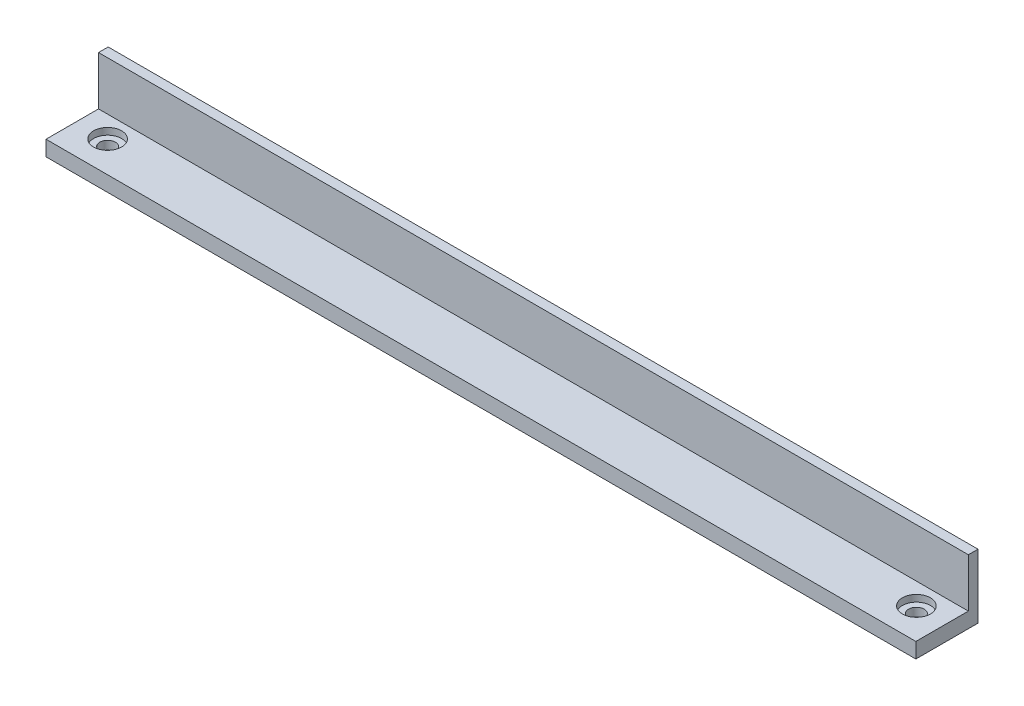
from build123d import *

# Parameters (mm, degrees)
SKETCH1_W           = 285
SKETCH1_H           = 17.2
SKETCH1_R           = 4.6
SKETCH1_H_2         = 3.16
SKETCH1_R_2         = 2.55
BOSS_EXTRUDE1_DEPTH = 5
BOSS_EXTRUDE2_START = 5
SKETCH1_3_W         = 285
SKETCH1_3_H         = 3.16
BOSS_EXTRUDE2_DEPTH = 16
CUT_EXTRUDE1_START  = 2.8
SKETCH1_5_R         = 4.6
SKETCH1_5_R_2       = 2.55
CUT_EXTRUDE1_DEPTH  = 2.2


with BuildPart() as part:
    # Sketch1 → Boss-Extrude1 (new body)
    # profile 1 of 4: a face of its own
    with BuildSketch(Plane(origin=(0, 0, 0), x_dir=(1, 0, 0), z_dir=(0, 1, 0))):
        with Locations((0, -1.58)):
            Rectangle(SKETCH1_W, SKETCH1_H)
        with Locations((-132.5, 0)):
            Circle(SKETCH1_R, mode=Mode.SUBTRACT)
        with Locations((132.5, 0)):
            Circle(SKETCH1_R, mode=Mode.SUBTRACT)
    # profile 2 of 4: a face of its own
    with BuildSketch(Plane(origin=(0, 0, 0), x_dir=(1, 0, 0), z_dir=(0, 1, 0))):
        with Locations((0, 8.6)):
            Rectangle(SKETCH1_W, SKETCH1_H_2)
    # profile 3 of 4: a face of its own
    with BuildSketch(Plane(origin=(0, 0, 0), x_dir=(1, 0, 0), z_dir=(0, 1, 0))):
        with Locations((-132.5, 0)):
            Circle(SKETCH1_R)
        with Locations(Location((-132.5, 0, 0), (0, 0, 270))):
            Circle(SKETCH1_R_2, mode=Mode.SUBTRACT)
    # profile 4 of 4: a face of its own
    with BuildSketch(Plane(origin=(0, 0, 0), x_dir=(1, 0, 0), z_dir=(0, 1, 0))):
        with Locations((132.5, 0)):
            Circle(SKETCH1_R)
        with Locations(Location((132.5, 0, 0), (0, 0, 270))):
            Circle(SKETCH1_R_2, mode=Mode.SUBTRACT)
    extrude(amount=BOSS_EXTRUDE1_DEPTH)

    # Sketch1<3> → Boss-Extrude2 (add)
    with BuildSketch(Plane(origin=(0, 0, 0), x_dir=(1, 0, 0), z_dir=(0, 1, 0)).offset(BOSS_EXTRUDE2_START)):
        with Locations((0, 8.6)):
            Rectangle(SKETCH1_3_W, SKETCH1_3_H)
    extrude(amount=BOSS_EXTRUDE2_DEPTH)

    # Sketch1<5> → Cut-Extrude1 (cut)
    # profile 1 of 2: a face of its own
    with BuildSketch(Plane(origin=(0, 0, 0), x_dir=(1, 0, 0), z_dir=(0, 1, 0)).offset(CUT_EXTRUDE1_START)):
        with Locations(Location((-132.5, 0, 0), (0, 0, 270))):
            Circle(SKETCH1_5_R)
        with Locations(Location((-132.5, 0, 0), (0, 0, 270))):
            Circle(SKETCH1_5_R_2, mode=Mode.SUBTRACT)
    # profile 2 of 2: a face of its own
    with BuildSketch(Plane(origin=(0, 0, 0), x_dir=(1, 0, 0), z_dir=(0, 1, 0)).offset(CUT_EXTRUDE1_START)):
        with Locations(Location((132.5, 0, 0), (0, 0, 270))):
            Circle(SKETCH1_5_R)
        with Locations(Location((132.5, 0, 0), (0, 0, 270))):
            Circle(SKETCH1_5_R_2, mode=Mode.SUBTRACT)
    extrude(amount=CUT_EXTRUDE1_DEPTH, mode=Mode.SUBTRACT)


solid = part.part
